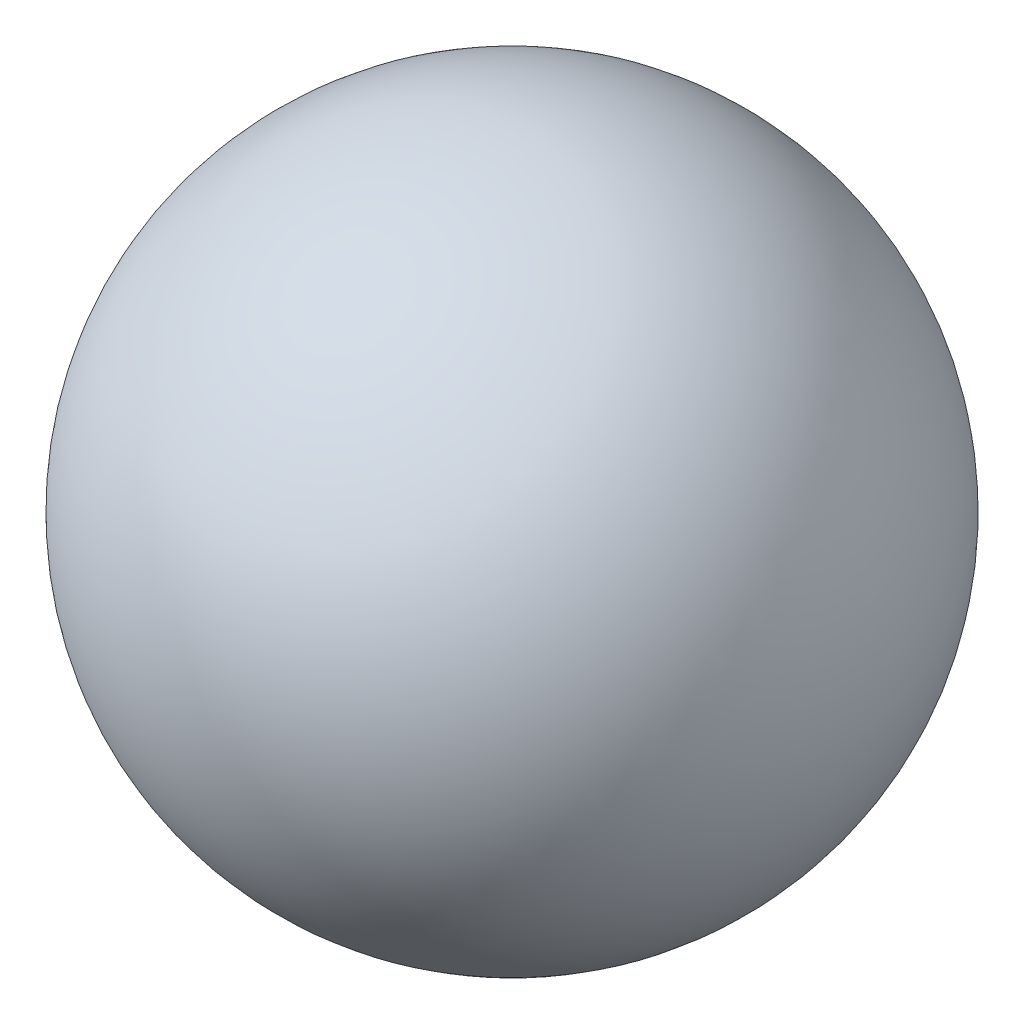
from build123d import *


with BuildPart() as part:
    # Esquisse1 → Révolution1 (revolve)
    with BuildSketch(Plane.XY):
        with BuildLine():
            Line((0, 5), (0, 4))
            ThreePointArc((0, 4), (-3.92634671, 0.76406905), (-1.5, -3.708099244))
            Line((-1.5, -3.708099244), (-1.5, -4.769696007))
            ThreePointArc((-1.5, -4.769696007), (-4.942088629, 0.758788496), (0, 5))
        make_face()
    revolve(axis=Axis((0, 5, 0), (0, -1, 0)))


solid = part.part
